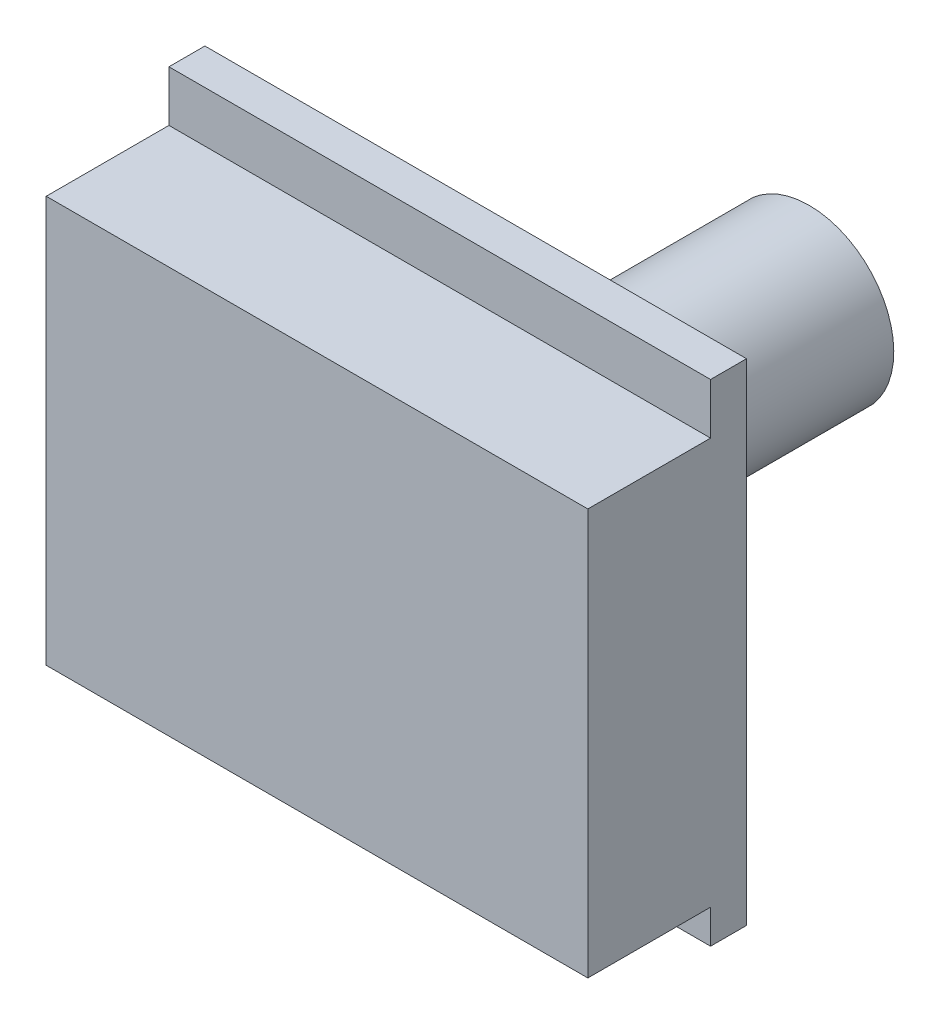
from build123d import *

# Parameters (mm, degrees)
SCHIZZO1_W                   = 12.8
SCHIZZO1_H                   = 9.6
SCHIZZO1_W_2                 = 11.3
SCHIZZO1_H_2                 = 8.1
ESTRUSIONE_ESTRUSIONE1_DEPTH = 3
SCHIZZO2_W                   = 12.8
SCHIZZO2_H                   = 9.6
ESTRUSIONE_ESTRUSIONE2_DEPTH = 0.75
SCHIZZO3_W                   = 12.8
SCHIZZO3_H                   = 1.2
SCHIZZO3_H_2                 = 0.8
ESTRUSIONE_ESTRUSIONE3_DEPTH = 0.85
ESTRUSIONE_ESTRUSIONE4_DEPTH = 3
SCHIZZO5_R                   = 2
ESTRUSIONE_ESTRUSIONE5_DEPTH = 7.88


with BuildPart() as part:
    # Schizzo1 → Estrusione-Estrusione1 (new body)
    with BuildSketch(Plane.XY):
        Rectangle(SCHIZZO1_W, SCHIZZO1_H)
        Rectangle(SCHIZZO1_W_2, SCHIZZO1_H_2, mode=Mode.SUBTRACT)
    extrude(amount=ESTRUSIONE_ESTRUSIONE1_DEPTH)

    # Schizzo2 → Estrusione-Estrusione2 (add)
    with BuildSketch(Plane.XY.offset(3)):
        Rectangle(SCHIZZO2_W, SCHIZZO2_H)
    extrude(amount=ESTRUSIONE_ESTRUSIONE2_DEPTH)

    # Schizzo3 → Estrusione-Estrusione3 (add)
    with BuildSketch(Plane(origin=(0, 0, 0), x_dir=(-1, 0, 0), z_dir=(0, 0, -1))):
        with Locations((0, 5.4)):
            Rectangle(SCHIZZO3_W, SCHIZZO3_H)
        with Locations((0, -5.2)):
            Rectangle(SCHIZZO3_W, SCHIZZO3_H_2)
    extrude(amount=-ESTRUSIONE_ESTRUSIONE3_DEPTH)



with BuildPart() as body_2:
    # Schizzo4 → Estrusione-Estrusione4 (new, through all)
    with BuildSketch(Plane(origin=(0, 0, 3), x_dir=(-1, 0, 0), z_dir=(0, 0, -1))):
        with BuildLine():
            Line((5.65, -0.5), (5.65, 0.5))
            Line((5.65, 0.5), (1.936491673, 0.5))
            ThreePointArc((1.936491673, 0.5), (1.414213562, 1.414213562), (0.5, 1.936491673))
            Line((0.5, 1.936491673), (0.5, 4.05))
            Line((0.5, 4.05), (-0.5, 4.05))
            Line((-0.5, 4.05), (-0.5, 1.936491673))
            ThreePointArc((-0.5, 1.936491673), (-1.414213562, 1.414213562), (-1.936491673, 0.5))
            Line((-1.936491673, 0.5), (-5.65, 0.5))
            Line((-5.65, 0.5), (-5.65, -0.5))
            Line((-5.65, -0.5), (-1.936491673, -0.5))
            ThreePointArc((-1.936491673, -0.5), (-1.414213562, -1.414213562), (-0.5, -1.936491673))
            Line((-0.5, -1.936491673), (-0.5, -4.05))
            Line((-0.5, -4.05), (0.5, -4.05))
            Line((0.5, -4.05), (0.5, -1.936491673))
            ThreePointArc((0.5, -1.936491673), (1.414213562, -1.414213562), (1.936491673, -0.5))
            Line((1.936491673, -0.5), (5.65, -0.5))
        make_face()
    extrude(amount=ESTRUSIONE_ESTRUSIONE4_DEPTH)


with BuildPart() as part_1:
    add(part.part)

    add(body_2.part)  # Estrusione-Estrusione5 merges body 2
    # Schizzo5 → Estrusione-Estrusione5 (add)
    with BuildSketch(Plane(origin=(0, 0, 0), x_dir=(-1, 0, 0), z_dir=(0, 0, -1))):
        with Locations(Location((0, 0, 0), (0, 0, 165.522487814))):
            Circle(SCHIZZO5_R)
    extrude(amount=ESTRUSIONE_ESTRUSIONE5_DEPTH)


solid = part_1.part
